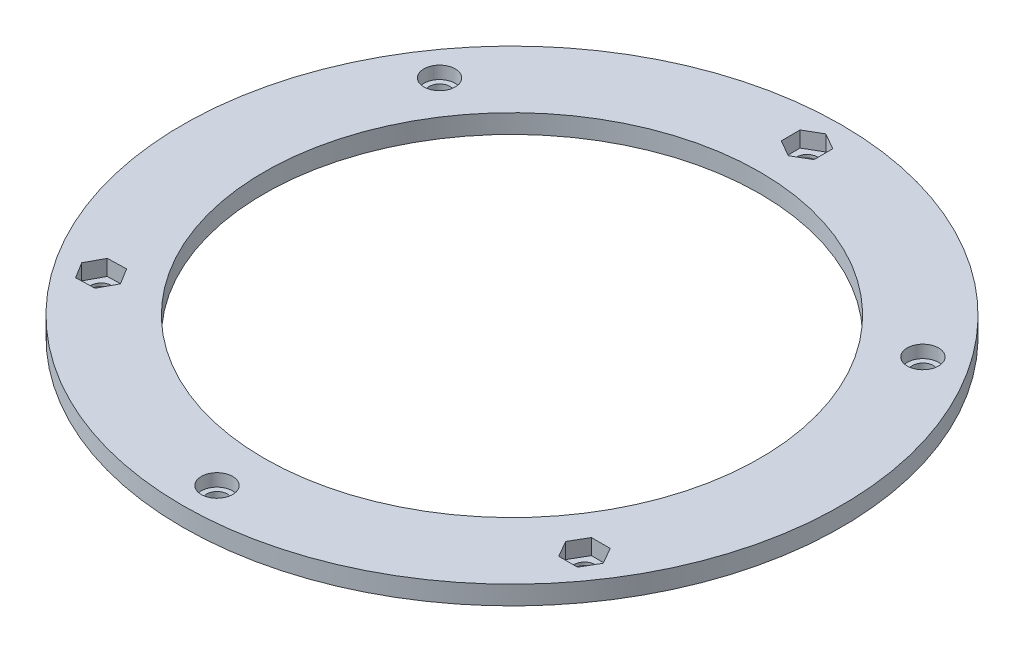
from build123d import *

# Parameters (mm, degrees)
SKETCH1_R           = 52.5
SKETCH1_R_2         = 39.5
BOSS_EXTRUDE1_DEPTH = 3
SKETCH2_R           = 1.65
CUT_EXTRUDE1_DEPTH  = 75.306796459
SKETCH3_R           = 2.5
CUT_EXTRUDE2_DEPTH  = 2
CUT_EXTRUDE3_DEPTH  = 2.5


with BuildPart() as part:
    # Sketch1 → Boss-Extrude1 (new body)
    with BuildSketch(Plane(origin=(0, 0, 0), x_dir=(1, 0, 0), z_dir=(0, 1, 0))):
        with Locations(Location((0, 0, 0), (0, 0, 270))):
            Circle(SKETCH1_R)
        with Locations(Location((0, 0, 0), (0, 0, 270))):
            Circle(SKETCH1_R_2, mode=Mode.SUBTRACT)
    extrude(amount=BOSS_EXTRUDE1_DEPTH)

    # Sketch2 → Cut-Extrude1 (cut, through all)
    with BuildSketch(Plane(origin=(0, 3, 0), x_dir=(1, 0, 0), z_dir=(0, 1, 0))):
        with Locations(Location((0, 47, 0), (0, 0, 270))):
            Circle(SKETCH2_R)
        with Locations(Location((0, -47, 0), (0, 0, 270))):
            Circle(SKETCH2_R)
        with Locations(Location((-38.500146082, 26.958092508, 0), (0, 0, 270))):
            Circle(SKETCH2_R)
        with Locations(Location((38.500146082, 26.958092508, 0), (0, 0, 270))):
            Circle(SKETCH2_R)
        with Locations(Location((38.500146082, -26.958092508, 0), (0, 0, 270))):
            Circle(SKETCH2_R)
        with Locations(Location((-38.500146082, -26.958092508, 0), (0, 0, 270))):
            Circle(SKETCH2_R)
    extrude(amount=-CUT_EXTRUDE1_DEPTH, mode=Mode.SUBTRACT)

    # Sketch3 → Cut-Extrude2 (cut)
    with BuildSketch(Plane(origin=(0, 3, 0), x_dir=(1, 0, 0), z_dir=(0, 1, 0))):
        with Locations(Location((-38.500146082, 26.958092508, 0), (0, 0, 270))):
            Circle(SKETCH3_R)
        with Locations(Location((38.500146082, 26.958092508, 0), (0, 0, 270))):
            Circle(SKETCH3_R)
        with Locations(Location((0, -47, 0), (0, 0, 270))):
            Circle(SKETCH3_R)
    extrude(amount=-CUT_EXTRUDE2_DEPTH, mode=Mode.SUBTRACT)

    # Sketch4 → Cut-Extrude3 (cut)
    with BuildSketch(Plane(origin=(0, 3, 0), x_dir=(1, 0, 0), z_dir=(0, 1, 0))):
        Polygon((-0.012280839, 49.999974863), (-2.604194862, 48.489351913), (-2.591914023, 45.48937705), (0.012280839, 44.000025137), (2.604194862, 45.510648087), (2.591914023, 48.51062295), align=None)
        Polygon((-40.07536917, -24.404923454), (-41.498866887, -27.045691193), (-39.923643798, -29.598860247), (-36.924922993, -29.511261563), (-35.501425276, -26.870493824), (-37.076648365, -24.31732477), align=None)
        Polygon((35.500146082, -26.958092508), (37.000146082, -29.55616872), (40.000146082, -29.55616872), (41.500146082, -26.958092508), (40.000146082, -24.360016297), (37.000146082, -24.360016297), align=None)
    extrude(amount=-CUT_EXTRUDE3_DEPTH, mode=Mode.SUBTRACT)


solid = part.part
